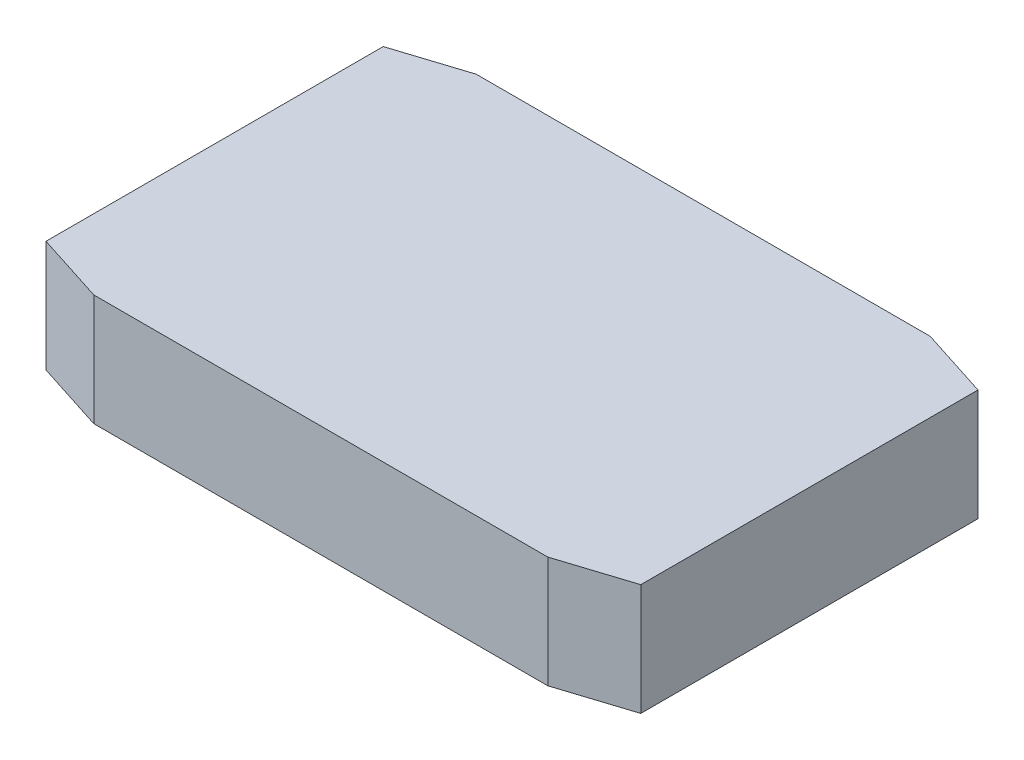
from build123d import *
from OCP.BRepFilletAPI import BRepFilletAPI_MakeChamfer

# Parameters (mm, degrees)
SKETCH1_W           = 224
SKETCH1_H           = 144
BOSS_EXTRUDE1_DEPTH = 42
SKETCH2_W           = 175
SKETCH2_H           = 11
BOSS_EXTRUDE2_DEPTH = 4.5
CHAMFER1_SIZE       = 8.5
CHAMFER1_SIZE2      = 26.5
CHAMFER2_SIZE       = 26.5
CHAMFER2_SIZE2      = 8.5


with BuildPart() as part:
    # Sketch1 → Boss-Extrude1 (new body)
    with BuildSketch(Plane(origin=(0, 0, 0), x_dir=(1, 0, 0), z_dir=(0, 1, 0))):
        with Locations((112, 72)):
            Rectangle(SKETCH1_W, SKETCH1_H)
    extrude(amount=BOSS_EXTRUDE1_DEPTH)

    # Sketch2 → Boss-Extrude2 (add)
    with BuildSketch(Plane.XZ):
        with Locations((112, -128.25)):
            Rectangle(SKETCH2_W, SKETCH2_H)
        with Locations((112, -15.75)):
            Rectangle(SKETCH2_W, SKETCH2_H)
    extrude(amount=BOSS_EXTRUDE2_DEPTH)

    # Chamfer1: one chamfer whose edges measure the first distance from different faces: ONE call of the kernel's chamfer builder (chamfer() names one face for all edges)
    chamfer1_edges_1 = [part.edges().sort_by_distance(p)[0] for p in [
        (224, 21, -144),
    ]]
    chamfer1_side_1 = [part.faces().sort_by_distance(p)[0] for p in [
        (224, 21, -72),
    ]]
    chamfer1_edges_2 = [part.edges().sort_by_distance(p)[0] for p in [
        (0, 21, 0),
    ]]
    chamfer1_side_2 = [part.faces().sort_by_distance(p)[0] for p in [
        (0, 21, -72),
    ]]
    chamfer1 = BRepFilletAPI_MakeChamfer(part.part.solid().wrapped)
    for e in chamfer1_edges_1:
        chamfer1.Add(CHAMFER1_SIZE, CHAMFER1_SIZE2, e.wrapped, chamfer1_side_1[0].wrapped)  # the first distance lies on this face
    for e in chamfer1_edges_2:
        chamfer1.Add(CHAMFER1_SIZE, CHAMFER1_SIZE2, e.wrapped, chamfer1_side_2[0].wrapped)  # the first distance lies on this face
    add(Compound.cast(chamfer1.Shape()), mode=Mode.REPLACE)

    # Chamfer2: one chamfer whose edges measure the first distance from different faces: ONE call of the kernel's chamfer builder (chamfer() names one face for all edges)
    chamfer2_edges_1 = [part.edges().sort_by_distance(p)[0] for p in [
        (0, 21, -144),
    ]]
    chamfer2_side_1 = [part.faces().sort_by_distance(p)[0] for p in [
        (98.75, 21, -144),
    ]]
    chamfer2_edges_2 = [part.edges().sort_by_distance(p)[0] for p in [
        (224, 21, 0),
    ]]
    chamfer2_side_2 = [part.faces().sort_by_distance(p)[0] for p in [
        (125.25, 21, 0),
    ]]
    chamfer2 = BRepFilletAPI_MakeChamfer(part.part.solid().wrapped)
    for e in chamfer2_edges_1:
        chamfer2.Add(CHAMFER2_SIZE, CHAMFER2_SIZE2, e.wrapped, chamfer2_side_1[0].wrapped)  # the first distance lies on this face
    for e in chamfer2_edges_2:
        chamfer2.Add(CHAMFER2_SIZE, CHAMFER2_SIZE2, e.wrapped, chamfer2_side_2[0].wrapped)  # the first distance lies on this face
    add(Compound.cast(chamfer2.Shape()), mode=Mode.REPLACE)


solid = part.part
